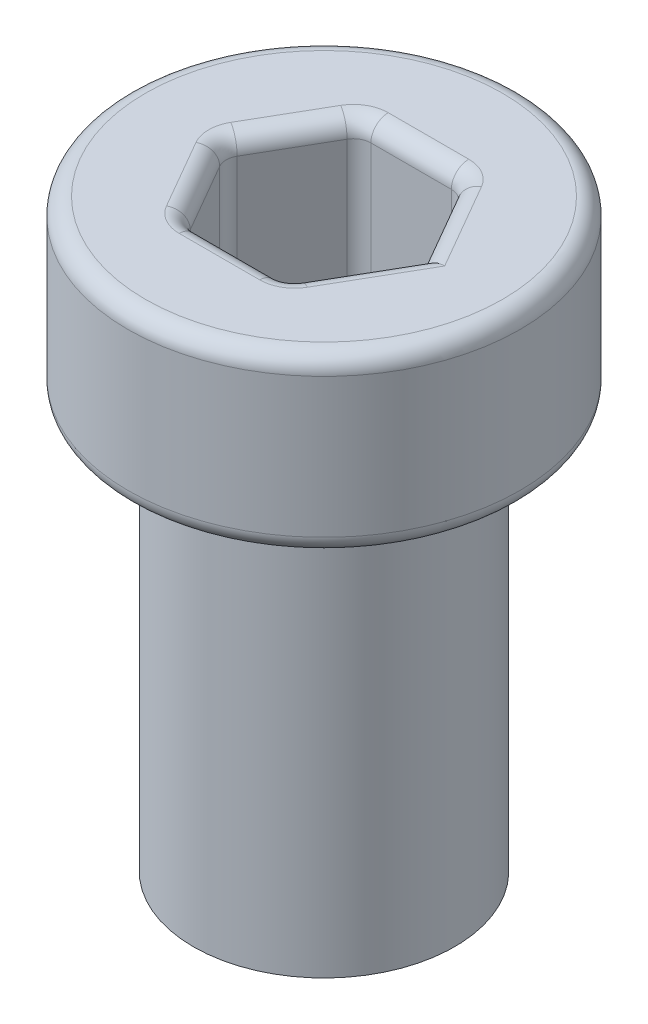
from build123d import *

# Parameters (mm, degrees)
HEAD_SKETCH_R                  = 2.25
HEAD_DEPTH                     = 2
THREADED_SECTION_STUB_SKETCH_R = 1.5
BOSS_EXTRUDE2_DEPTH            = 5
END_OF_BOLT_CHAMFER_SIZE       = 0.5
END_OF_BOLT_CHAMFER_SIZE2      = 0.288675135
COSMETIC_FILLETS_R             = 0.2


with BuildPart() as part:
    # Head Sketch → Head (new body)
    with BuildSketch(Plane(origin=(0, 0, 0), x_dir=(1, 0, 0), z_dir=(0, 1, 0))):
        with Locations(Location((0, 0, 0), (0, 0, 270))):
            Circle(HEAD_SKETCH_R)
        Polygon((-0.577350269, 1), (-1.154700538, 0), (-0.577350269, -1), (0.577350269, -1), (1.154700538, 0), (0.577350269, 1), align=None, mode=Mode.SUBTRACT)
    extrude(amount=HEAD_DEPTH)

    # Threaded Section Stub Sketch → Boss-Extrude2 (add)
    with BuildSketch(Plane(origin=(0, 0, 0), x_dir=(1, 0, 0), z_dir=(0, 1, 0))):
        with Locations(Location((0, 0, 0), (0, 0, 270))):
            Circle(THREADED_SECTION_STUB_SKETCH_R)
    extrude(amount=-BOSS_EXTRUDE2_DEPTH)

    # End Of Bolt chamfer
    end_of_bolt_chamfer_edges = [part.edges().sort_by_distance(p)[0] for p in [
        (0, -5, -1.5),
    ]]
    end_of_bolt_chamfer_side = [part.faces().sort_by_distance(p)[0] for p in [
        (0, -5, 0),
    ]]
    chamfer(end_of_bolt_chamfer_edges, length=END_OF_BOLT_CHAMFER_SIZE, length2=END_OF_BOLT_CHAMFER_SIZE2, reference=end_of_bolt_chamfer_side[0])

    # Cosmetic Fillets
    cosmetic_fillets_edges = [part.edges().sort_by_distance(p)[0] for p in [
        (-0.577350269, 1, -1),
        (-0.8660254037844384, 0, 0.5000000000000003),
        (-1.154700538, 1, 0),
        (0, 0, 1),
        (-0.577350269, 1, 1),
        (0.8660254037844388, 0, 0.4999999999999998),
        (0.577350269, 1, 1),
        (0.8660254037844388, 0, -0.5000000000000002),
        (0, 2, -1),
        (-0.866025404, 2, -0.5),
        (-0.866025404, 2, 0.5),
        (0, 2, 1),
        (0.866025404, 2, 0.5),
        (0.866025404, 2, -0.5),
        (0, 0, -2.25),
        (0, 2, -2.25),
        (0, 0, -1),
        (0.577350269, 1, -1),
        (-0.8660254037844386, 0, -0.4999999999999998),
    ]]
    fillet(cosmetic_fillets_edges, radius=COSMETIC_FILLETS_R)


solid = part.part
